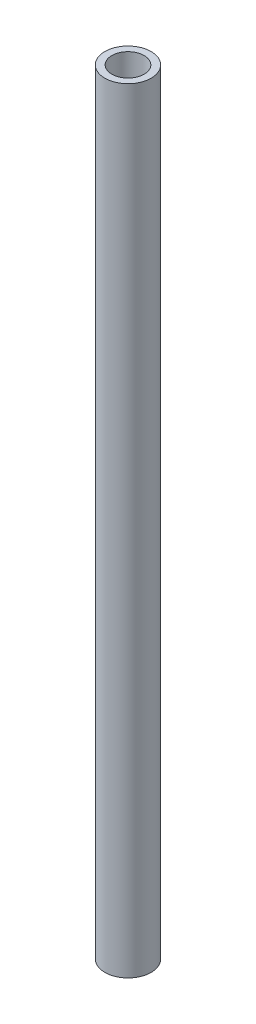
from build123d import *

# Parameters (mm, degrees)
SKETCH1_W = 3
SKETCH1_H = 335


with BuildPart() as part:
    # Sketch1 → Revolve-Thin1 (revolve)
    with BuildSketch(Plane.XY, mode=Mode.PRIVATE) as revolve_thin1_sk:
        with Locations((146.796178344, 209.108280255)):
            Rectangle(SKETCH1_W, SKETCH1_H)
    revolve(revolve_thin1_sk.sketch.rotate(Axis((138.296178344, 709.474522293, 0), (0, -1, 0)), 180), axis=Axis((138.296178344, 709.474522293, 0), (0, -1, 0)))


solid = part.part
